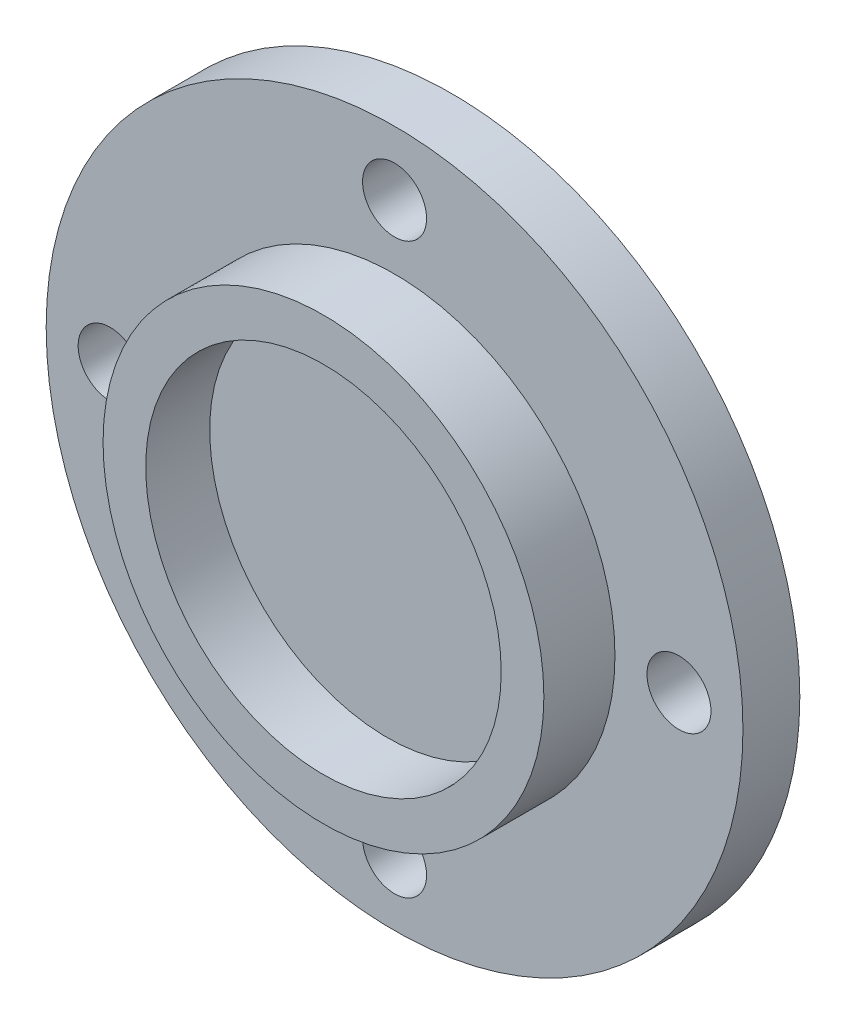
from build123d import *

# Parameters (mm, degrees)
SKETCH_1_R          = 49
EXTRUDE_1_DEPTH     = 8
SKETCH_2_R          = 31
EXTRUDE_2_DEPTH     = 10
SKETCH_3_R          = 25
CUT_EXTRUDE_1_DEPTH = 9
SKETCH_4_R          = 4.5
CUT_EXTRUDE_2_DEPTH = 49


with BuildPart() as part:
    # 草图1 → 凸台-拉伸1 (new body)
    with BuildSketch(Plane.XY):
        Circle(SKETCH_1_R)
    extrude(amount=EXTRUDE_1_DEPTH)

    # 草图2 → 凸台-拉伸2 (add)
    with BuildSketch(Plane.XY.offset(8)):
        Circle(SKETCH_2_R)
    extrude(amount=EXTRUDE_2_DEPTH)

    # 草图3 → 切除-拉伸1 (cut)
    with BuildSketch(Plane.XY.offset(18)):
        Circle(SKETCH_3_R)
    extrude(amount=-CUT_EXTRUDE_1_DEPTH, mode=Mode.SUBTRACT)

    # 草图4 → 切除-拉伸2 (cut)
    with BuildSketch(Plane.XY.offset(8)):
        with Locations((0, 40)):
            Circle(SKETCH_4_R)
        with Locations((40, 0)):
            Circle(SKETCH_4_R)
        with Locations((0, -40)):
            Circle(SKETCH_4_R)
        with Locations((-40, 0)):
            Circle(SKETCH_4_R)
    extrude(amount=-CUT_EXTRUDE_2_DEPTH, mode=Mode.SUBTRACT)


solid = part.part
